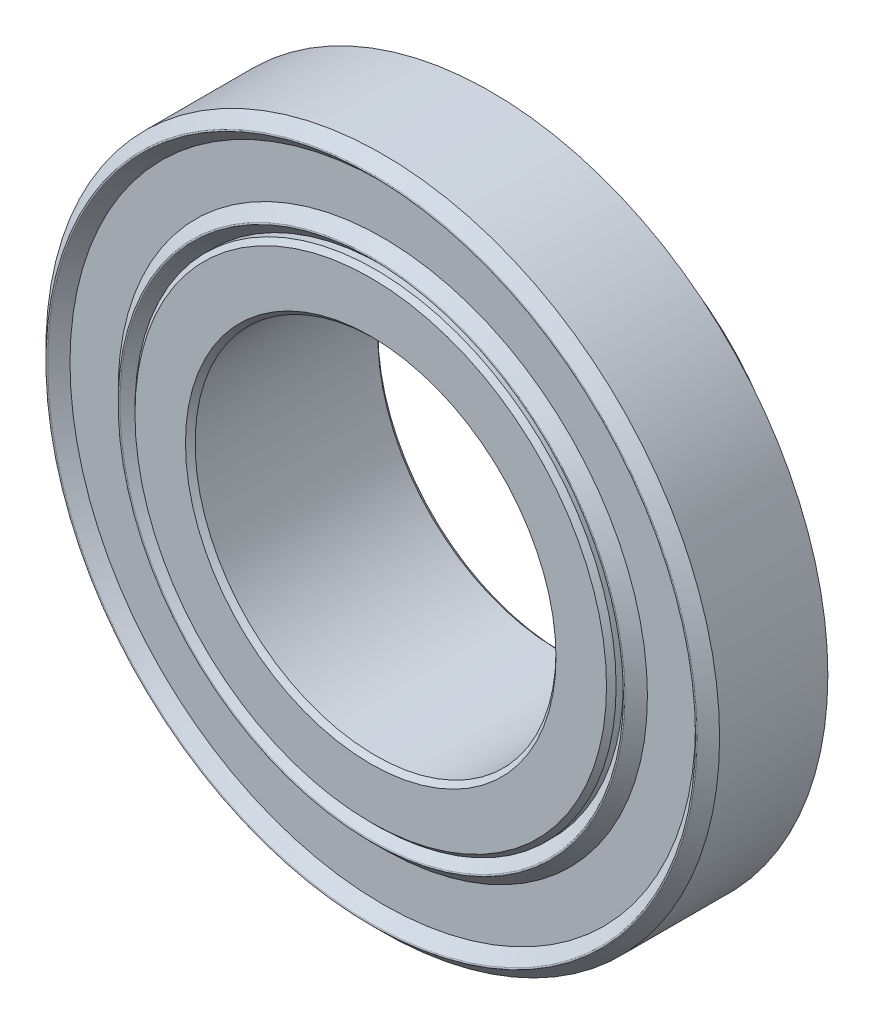
from build123d import *

# Parameters (mm, degrees)
SKETCH_4_R      = 10
SKETCH_4_R_2    = 7.5
EXTRUDE_1_DEPTH = 8
CHAMFER_1_SIZE  = 0.2


with BuildPart() as part:
    # 草圖2 → 旋轉1 (revolve)
    with BuildSketch(Plane(origin=(0, 0, 0), x_dir=(1, 0, 0), z_dir=(0, 1, 0))):
        with BuildLine():
            Line((10, 5), (14, 5))
            Line((14, 5), (14, 0.5))
            Line((14, 0.5), (13.535355339, 0.035355339))
            ThreePointArc((13.535355339, 0.035355339), (13.5, 0.020710678), (13.464644661, 0.035355339))
            Line((13.464644661, 0.035355339), (13, 0.5))
            Line((13, 0.5), (11, 0.5))
            Line((11, 0.5), (10.535355339, 0.035355339))
            ThreePointArc((10.535355339, 0.035355339), (10.5, 0.020710678), (10.464644661, 0.035355339))
            Line((10.464644661, 0.035355339), (10, 0.5))
            Line((10, 0.5), (10, 5))
        make_face()
    revolve(axis=Axis((0, 0, 0), (0, 0, -1)))


with BuildPart() as body_2:
    # 草圖4 → 填料-伸長1 (new body)
    with BuildSketch(Plane.XY):
        Circle(SKETCH_4_R)
        Circle(SKETCH_4_R_2, mode=Mode.SUBTRACT)
    extrude(amount=-EXTRUDE_1_DEPTH)

    # 導角1
    chamfer_1_edges = [body_2.edges().sort_by_distance(p)[0] for p in [
        (-10, 0, 0),
        (-10, 0, -8),
        (-7.5, 0, -8),
        (-7.5, 0, 0),
    ]]
    chamfer(chamfer_1_edges, length=CHAMFER_1_SIZE)


solid = Compound([part.part, body_2.part])
